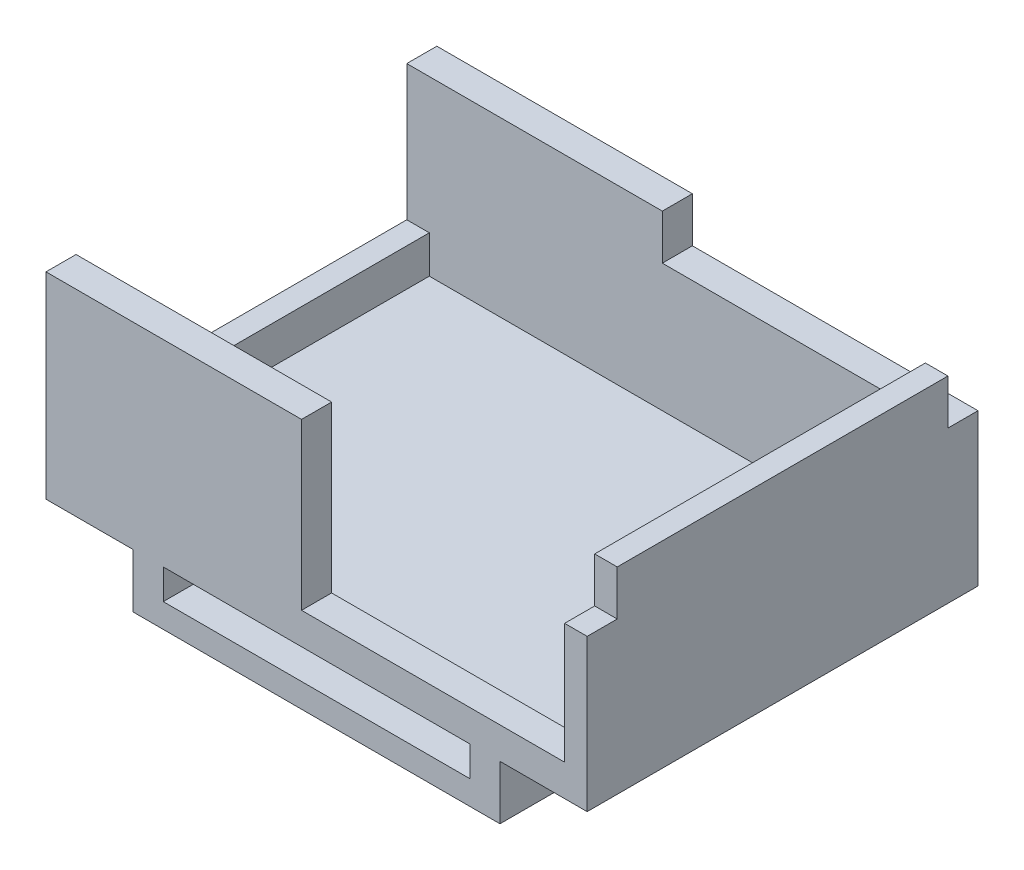
from build123d import *

# Parameters (mm, degrees)
SKETCH_1_W          = 36
SKETCH_1_H          = 26
EXTRUDE_1_DEPTH     = 14.6
SKETCH_2_W          = 33
SKETCH_2_H          = 22
CUT_EXTRUDE_1_DEPTH = 13
SKETCH_3_W          = 36
SKETCH_3_H          = 26
CUT_EXTRUDE_2_DEPTH = 4.5
SKETCH_4_W          = 1.5
SKETCH_4_H          = 22
CUT_EXTRUDE_3_DEPTH = 6
SKETCH_5_W          = 2
SKETCH_5_H          = 4
EXTRUDE_2_DEPTH     = 2
SKETCH_6_W          = 24.4
SKETCH_6_H          = 4
EXTRUDE_3_DEPTH     = 1.6
SKETCH_7_W          = 17
SKETCH_7_H          = 2
SKETCH_7_W_2        = 1.5
SKETCH_7_H_2        = 22
EXTRUDE_4_DEPTH     = 3
SKETCH_8_W          = 17.5
SKETCH_8_H          = 2
CUT_EXTRUDE_5_DEPTH = 8


with BuildPart() as part:
    # 草图1 → 凸台-拉伸1 (new body)
    with BuildSketch(Plane(origin=(0, 0, 0), x_dir=(1, 0, 0), z_dir=(0, 1, 0))):
        Rectangle(SKETCH_1_W, SKETCH_1_H)
    extrude(amount=EXTRUDE_1_DEPTH)

    # 草图2 → 切除-拉伸1 (cut)
    with BuildSketch(Plane(origin=(0, 14.6, 0), x_dir=(1, 0, 0), z_dir=(0, 1, 0))):
        Rectangle(SKETCH_2_W, SKETCH_2_H)
    extrude(amount=-CUT_EXTRUDE_1_DEPTH, mode=Mode.SUBTRACT)

    # 草图3 → 切除-拉伸2 (cut)
    with BuildSketch(Plane(origin=(0, 14.6, 0), x_dir=(1, 0, 0), z_dir=(0, 1, 0))):
        Rectangle(SKETCH_3_W, SKETCH_3_H)
    extrude(amount=-CUT_EXTRUDE_2_DEPTH, mode=Mode.SUBTRACT)

    # 草图4 → 切除-拉伸3 (cut)
    with BuildSketch(Plane(origin=(0, 10.1, 0), x_dir=(1, 0, 0), z_dir=(0, 1, 0))):
        with Locations((-17.25, 0)):
            Rectangle(SKETCH_4_W, SKETCH_4_H)
    extrude(amount=-CUT_EXTRUDE_3_DEPTH, mode=Mode.SUBTRACT)

    # 草图5 → 凸台-拉伸2 (add)
    with BuildSketch(Plane(origin=(0, 0, 0), x_dir=(-1, 0, 0), z_dir=(0, -1, 0))):
        with Locations((-11.2, -11)):
            Rectangle(SKETCH_5_W, SKETCH_5_H)
        with Locations((11.2, -11)):
            Rectangle(SKETCH_5_W, SKETCH_5_H)
        with Locations((-11.2, 11)):
            Rectangle(SKETCH_5_W, SKETCH_5_H)
        with Locations((11.2, 11)):
            Rectangle(SKETCH_5_W, SKETCH_5_H)
    extrude(amount=EXTRUDE_2_DEPTH)

    # 草图6 → 凸台-拉伸3 (add)
    with BuildSketch(Plane(origin=(0, -2, 0), x_dir=(-1, 0, 0), z_dir=(0, -1, 0))):
        with Locations((0, -11)):
            Rectangle(SKETCH_6_W, SKETCH_6_H)
        with Locations((0, 11)):
            Rectangle(SKETCH_6_W, SKETCH_6_H)
    extrude(amount=EXTRUDE_3_DEPTH)

    # 草图7 → 凸台-拉伸4 (add)
    with BuildSketch(Plane(origin=(0, 10.1, 0), x_dir=(1, 0, 0), z_dir=(0, 1, 0))):
        with Locations((-9.5, 12)):
            Rectangle(SKETCH_7_W, SKETCH_7_H)
        with Locations((-9.5, -12)):
            Rectangle(SKETCH_7_W, SKETCH_7_H)
        with Locations((17.25, 0)):
            Rectangle(SKETCH_7_W_2, SKETCH_7_H_2)
    extrude(amount=EXTRUDE_4_DEPTH)

    # 草图8 → 切除-拉伸5 (cut)
    with BuildSketch(Plane(origin=(0, 10.1, 0), x_dir=(1, 0, 0), z_dir=(0, 1, 0))):
        with Locations((7.75, -12)):
            Rectangle(SKETCH_8_W, SKETCH_8_H)
    extrude(amount=-CUT_EXTRUDE_5_DEPTH, mode=Mode.SUBTRACT)


solid = part.part
